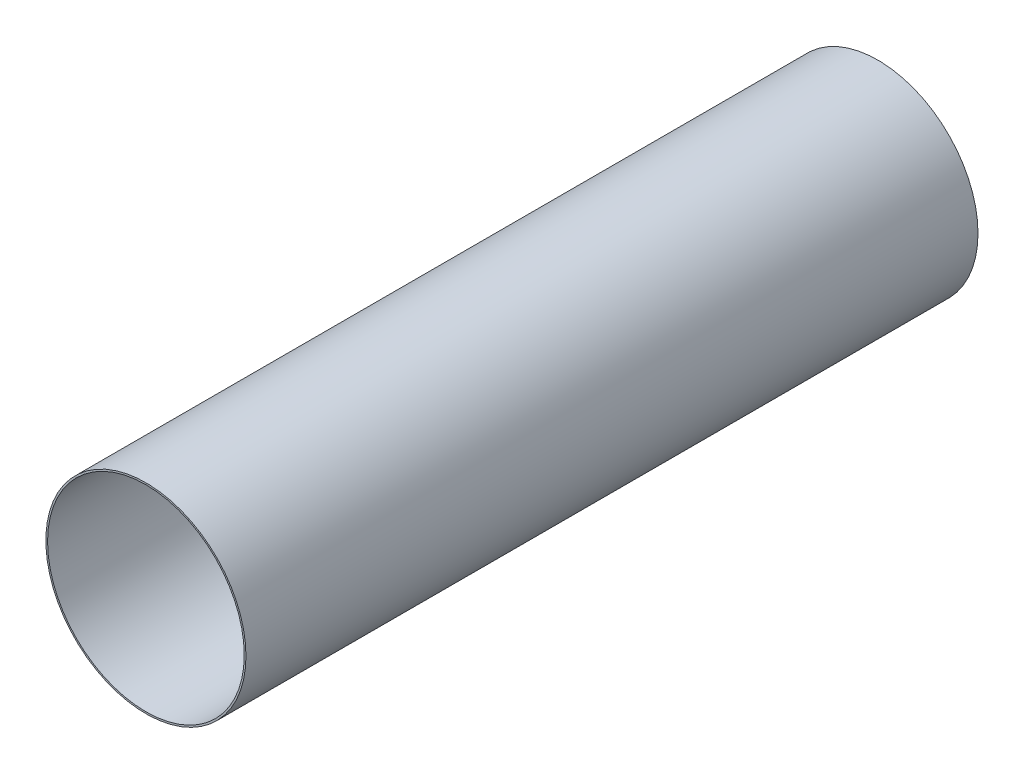
from build123d import *

# Parameters (mm, degrees)
SKETCH_1_R      = 115
EXTRUDE_1_DEPTH = 856
SHELL_2_T       = 2


with BuildPart() as part:
    # Эскиз1 → Бобышка-Вытянуть1 (new body)
    with BuildSketch(Plane.XY):
        Circle(SKETCH_1_R)
    extrude(amount=-EXTRUDE_1_DEPTH)

    # Оболочка2
    shell_2_openings = [part.faces().sort_by_distance(p)[0] for p in [
        (0, 0, 0),
        (0, 0, -856),
    ]]
    offset(amount=SHELL_2_T, openings=shell_2_openings, kind=Kind.INTERSECTION)


solid = part.part
